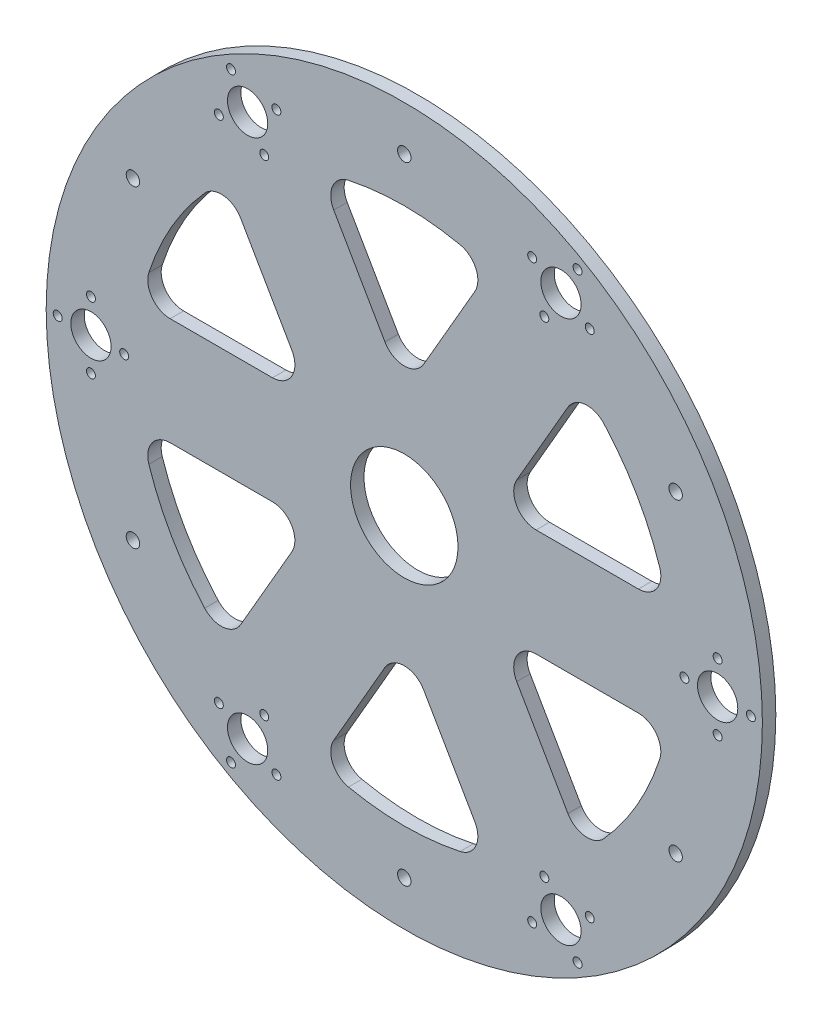
from build123d import *

# Parameters (mm, degrees)
SKETCH1_R           = 4.5
SKETCH1_R_2         = 1
SKETCH1_R_3         = 12
SKETCH1_R_4         = 1.5
BOSS_EXTRUDE1_DEPTH = 3


with BuildPart() as part:
    # Sketch1 → Boss-Extrude1 (new body)
    with BuildSketch(Plane.XY):
        with BuildLine():
            ThreePointArc((-55.722139859, -57.402466232), (-15.796115106, -78.425013532), (29.155135021, -74.498175158))
            ThreePointArc((29.155135021, -74.498175158), (69.282032303, -40), (79.094879733, 12))
            ThreePointArc((79.094879733, 12), (40, 69.282032303), (-29.155135021, 74.498175158))
            ThreePointArc((-29.155135021, 74.498175158), (-78.425013532, 15.796115106), (-55.722139859, -57.402466232))
        make_face()
        with Locations((70, 0)):
            Circle(SKETCH1_R, mode=Mode.SUBTRACT)
        with Locations((77.425, 0)):
            Circle(SKETCH1_R_2, mode=Mode.SUBTRACT)
        with Locations((70, 7.425)):
            Circle(SKETCH1_R_2, mode=Mode.SUBTRACT)
        with Locations((62.575, 0)):
            Circle(SKETCH1_R_2, mode=Mode.SUBTRACT)
        with Locations((70, -7.425)):
            Circle(SKETCH1_R_2, mode=Mode.SUBTRACT)
        with Locations((35, -60.621778265)):
            Circle(SKETCH1_R, mode=Mode.SUBTRACT)
        with Locations((41.430238623, -56.909278265)):
            Circle(SKETCH1_R_2, mode=Mode.SUBTRACT)
        with Locations((38.7125, -67.052016888)):
            Circle(SKETCH1_R_2, mode=Mode.SUBTRACT)
        with Locations((28.569761377, -64.334278265)):
            Circle(SKETCH1_R_2, mode=Mode.SUBTRACT)
        with Locations((31.2875, -54.191539642)):
            Circle(SKETCH1_R_2, mode=Mode.SUBTRACT)
        with Locations((-35, -60.621778265)):
            Circle(SKETCH1_R, mode=Mode.SUBTRACT)
        with Locations((-28.569761377, -64.334278265)):
            Circle(SKETCH1_R_2, mode=Mode.SUBTRACT)
        with Locations((-38.7125, -67.052016888)):
            Circle(SKETCH1_R_2, mode=Mode.SUBTRACT)
        with Locations((-41.430238623, -56.909278265)):
            Circle(SKETCH1_R_2, mode=Mode.SUBTRACT)
        with Locations((-31.2875, -54.191539642)):
            Circle(SKETCH1_R_2, mode=Mode.SUBTRACT)
        with Locations((-70, 0)):
            Circle(SKETCH1_R, mode=Mode.SUBTRACT)
        with Locations((-70, -7.425)):
            Circle(SKETCH1_R_2, mode=Mode.SUBTRACT)
        with Locations((-77.425, 0)):
            Circle(SKETCH1_R_2, mode=Mode.SUBTRACT)
        with Locations((-70, 7.425)):
            Circle(SKETCH1_R_2, mode=Mode.SUBTRACT)
        with Locations((-62.575, 0)):
            Circle(SKETCH1_R_2, mode=Mode.SUBTRACT)
        with Locations((-35, 60.621778265)):
            Circle(SKETCH1_R, mode=Mode.SUBTRACT)
        with Locations((-41.430238623, 56.909278265)):
            Circle(SKETCH1_R_2, mode=Mode.SUBTRACT)
        with Locations((-38.7125, 67.052016888)):
            Circle(SKETCH1_R_2, mode=Mode.SUBTRACT)
        with Locations((-28.569761377, 64.334278265)):
            Circle(SKETCH1_R_2, mode=Mode.SUBTRACT)
        with Locations((-31.2875, 54.191539642)):
            Circle(SKETCH1_R_2, mode=Mode.SUBTRACT)
        with Locations((35, 60.621778265)):
            Circle(SKETCH1_R, mode=Mode.SUBTRACT)
        with Locations((28.569761377, 64.334278265)):
            Circle(SKETCH1_R_2, mode=Mode.SUBTRACT)
        with Locations((38.7125, 67.052016888)):
            Circle(SKETCH1_R_2, mode=Mode.SUBTRACT)
        with Locations((41.430238623, 56.909278265)):
            Circle(SKETCH1_R_2, mode=Mode.SUBTRACT)
        with Locations((31.2875, 54.191539642)):
            Circle(SKETCH1_R_2, mode=Mode.SUBTRACT)
        Circle(SKETCH1_R_3, mode=Mode.SUBTRACT)
        with Locations((0, 70)):
            Circle(SKETCH1_R_4, mode=Mode.SUBTRACT)
        with Locations((60.621778265, 35)):
            Circle(SKETCH1_R_4, mode=Mode.SUBTRACT)
        with Locations((60.621778265, -35)):
            Circle(SKETCH1_R_4, mode=Mode.SUBTRACT)
        with Locations((0, -70)):
            Circle(SKETCH1_R_4, mode=Mode.SUBTRACT)
        with Locations((-60.621778265, -35)):
            Circle(SKETCH1_R_4, mode=Mode.SUBTRACT)
        with Locations((-60.621778265, 35)):
            Circle(SKETCH1_R_4, mode=Mode.SUBTRACT)
        with BuildLine():
            Line((-36.545698507, 39.299006612), (-25.11473671, 19.5))
            ThreePointArc((-25.11473671, 19.5), (-25.11473671, 14.5), (-29.444863729, 12))
            Line((-29.444863729, 12), (-52.306787322, 12))
            ThreePointArc((-52.306787322, 12), (-56.351986497, 14.061230932), (-57.061949806, 18.545454545))
            ThreePointArc((-57.061949806, 18.545454545), (-51.961524227, 30), (-44.591809664, 40.144370849))
            ThreePointArc((-44.591809664, 40.144370849), (-40.353376444, 41.771636394), (-36.545698507, 39.299006612))
        make_face(mode=Mode.SUBTRACT)
        with BuildLine():
            Line((15.761088816, 51.299006612), (4.330127019, 31.5))
            ThreePointArc((4.330127019, 31.5), (0, 29), (-4.330127019, 31.5))
            Line((-4.330127019, 31.5), (-15.761088816, 51.299006612))
            ThreePointArc((-15.761088816, 51.299006612), (-15.998610053, 55.832867326), (-12.470140142, 58.689825394))
            ThreePointArc((-12.470140142, 58.689825394), (0, 60), (12.470140142, 58.689825394))
            ThreePointArc((12.470140142, 58.689825394), (15.998610053, 55.832867326), (15.761088816, 51.299006612))
        make_face(mode=Mode.SUBTRACT)
        with BuildLine():
            Line((36.545698507, 39.299006612), (25.11473671, 19.5))
            ThreePointArc((25.11473671, 19.5), (25.11473671, 14.5), (29.444863729, 12))
            Line((29.444863729, 12), (52.306787322, 12))
            ThreePointArc((52.306787322, 12), (56.351986497, 14.061230932), (57.061949806, 18.545454545))
            ThreePointArc((57.061949806, 18.545454545), (51.961524227, 30), (44.591809664, 40.144370849))
            ThreePointArc((44.591809664, 40.144370849), (40.353376444, 41.771636394), (36.545698507, 39.299006612))
        make_face(mode=Mode.SUBTRACT)
        with BuildLine():
            Line((52.306787322, -12), (29.444863729, -12))
            ThreePointArc((29.444863729, -12), (25.11473671, -14.5), (25.11473671, -19.5))
            Line((25.11473671, -19.5), (36.545698507, -39.299006612))
            ThreePointArc((36.545698507, -39.299006612), (40.353376444, -41.771636394), (44.591809664, -40.144370849))
            ThreePointArc((44.591809664, -40.144370849), (51.961524227, -30), (57.061949806, -18.545454545))
            ThreePointArc((57.061949806, -18.545454545), (56.351986497, -14.061230932), (52.306787322, -12))
        make_face(mode=Mode.SUBTRACT)
        with BuildLine():
            Line((15.761088816, -51.299006612), (4.330127019, -31.5))
            ThreePointArc((4.330127019, -31.5), (0, -29), (-4.330127019, -31.5))
            Line((-4.330127019, -31.5), (-15.761088816, -51.299006612))
            ThreePointArc((-15.761088816, -51.299006612), (-15.998610053, -55.832867326), (-12.470140142, -58.689825395))
            ThreePointArc((-12.470140142, -58.689825395), (0, -60), (12.470140142, -58.689825394))
            ThreePointArc((12.470140142, -58.689825394), (15.998610053, -55.832867326), (15.761088816, -51.299006612))
        make_face(mode=Mode.SUBTRACT)
        with BuildLine():
            Line((-36.545698507, -39.299006612), (-25.11473671, -19.5))
            ThreePointArc((-25.11473671, -19.5), (-25.11473671, -14.5), (-29.444863729, -12))
            Line((-29.444863729, -12), (-52.306787322, -12))
            ThreePointArc((-52.306787322, -12), (-56.351986497, -14.061230932), (-57.061949806, -18.545454545))
            ThreePointArc((-57.061949806, -18.545454545), (-51.961524227, -30), (-44.591809664, -40.144370849))
            ThreePointArc((-44.591809664, -40.144370849), (-40.353376444, -41.771636394), (-36.545698507, -39.299006612))
        make_face(mode=Mode.SUBTRACT)
    extrude(amount=BOSS_EXTRUDE1_DEPTH)


solid = part.part
